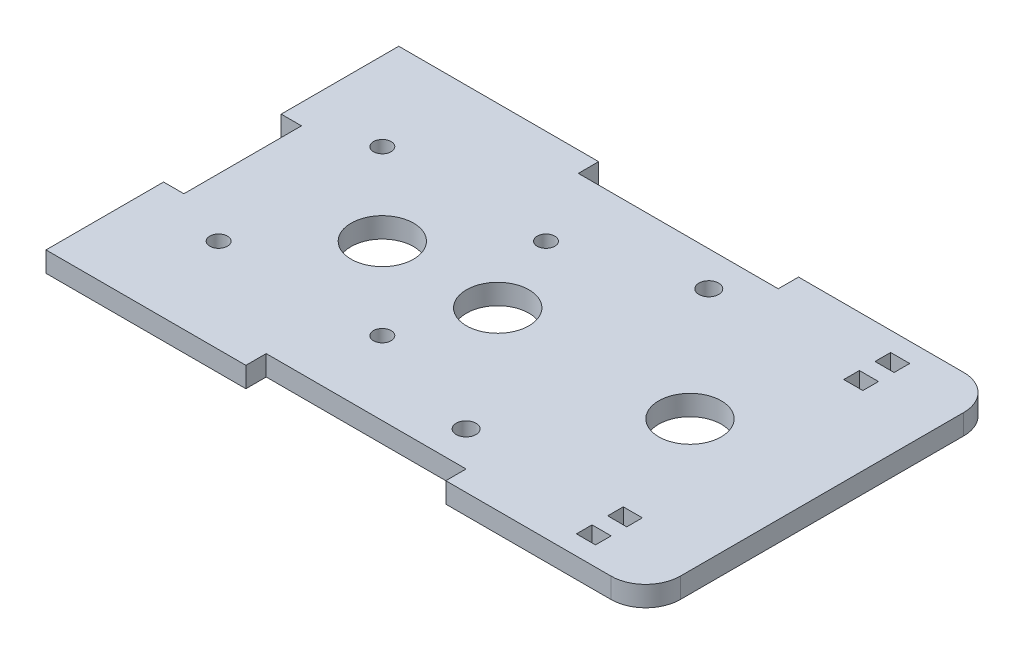
from build123d import *

# Parameters (mm, degrees)
SKETCH1_W           = 172.72
SKETCH1_H           = 101.6
BOSS_EXTRUDE1_DEPTH = 5.85
SKETCH4_W           = 5.85
SKETCH4_H           = 33.866666666
SKETCH4_W_2         = 57.573333334
SKETCH4_H_2         = 5.85
SKETCH4_W_3         = 5.5
SKETCH4_H_3         = 4.5
CUT_EXTRUDE5_DEPTH  = 10
SKETCH5_R           = 9
SKETCH5_R_2         = 2.54
CUT_EXTRUDE10_DEPTH = 16
FILLET1_R           = 10
SKETCH6_R           = 2.85
CUT_EXTRUDE11_DEPTH = 10


with BuildPart() as part:
    # Sketch1 → Boss-Extrude1 (new body)
    with BuildSketch(Plane(origin=(0, 0, 0), x_dir=(1, 0, 0), z_dir=(0, 1, 0))):
        Rectangle(SKETCH1_W, SKETCH1_H)
    extrude(amount=BOSS_EXTRUDE1_DEPTH)

    # Sketch4 → Cut-Extrude5 (cut)
    with BuildSketch(Plane(origin=(0, 5.85, 0), x_dir=(1, 0, 0), z_dir=(0, 1, 0))):
        with Locations((-83.435, 0)):
            Rectangle(SKETCH4_W, SKETCH4_H)
        with Locations((0, -47.875)):
            Rectangle(SKETCH4_W_2, SKETCH4_H_2)
        with Locations((0, 47.875)):
            Rectangle(SKETCH4_W_2, SKETCH4_H_2)
        with Locations((63.61, 43)):
            Rectangle(SKETCH4_W_3, SKETCH4_H_3)
        with Locations((63.61, -43)):
            Rectangle(SKETCH4_W_3, SKETCH4_H_3)
        with Locations((63.61, -34)):
            Rectangle(SKETCH4_W_3, SKETCH4_H_3)
        with Locations((63.61, 34)):
            Rectangle(SKETCH4_W_3, SKETCH4_H_3)
    extrude(amount=-CUT_EXTRUDE5_DEPTH, mode=Mode.SUBTRACT)

    # Sketch5 → Cut-Extrude10 (cut)
    with BuildSketch(Plane(origin=(0, 0, 0), x_dir=(1, 0, 0), z_dir=(0, 1, 0))):
        with Locations((-6.8720506, -0.189440326)):
            Circle(SKETCH5_R)
        with Locations((-40.10375, -0.189440326)):
            Circle(SKETCH5_R)
        with Locations((-63.676922318, 23.383731992)):
            Circle(SKETCH5_R_2)
        with Locations((-16.530577682, 23.383731992)):
            Circle(SKETCH5_R_2)
        with Locations((-63.676922318, -23.762612643)):
            Circle(SKETCH5_R_2)
        with Locations((-16.530577682, -23.762612643)):
            Circle(SKETCH5_R_2)
        with Locations((48.5139194, -0.189440326)):
            Circle(SKETCH5_R)
    extrude(amount=CUT_EXTRUDE10_DEPTH, mode=Mode.SUBTRACT)

    # Fillet1
    fillet1_edges = [part.edges().sort_by_distance(p)[0] for p in [
        (86.36, 2.925, -50.8),
        (86.36, 2.925, 50.8),
    ]]
    fillet(fillet1_edges, radius=FILLET1_R)

    # Sketch6 → Cut-Extrude11 (cut)
    with BuildSketch(Plane(origin=(0, 5.85, 0), x_dir=(1, 0, 0), z_dir=(0, 1, 0))):
        with Locations((18.786666667, -34.95)):
            Circle(SKETCH6_R)
        with Locations((18.786666667, 34.95)):
            Circle(SKETCH6_R)
    extrude(amount=-CUT_EXTRUDE11_DEPTH, mode=Mode.SUBTRACT)


solid = part.part
